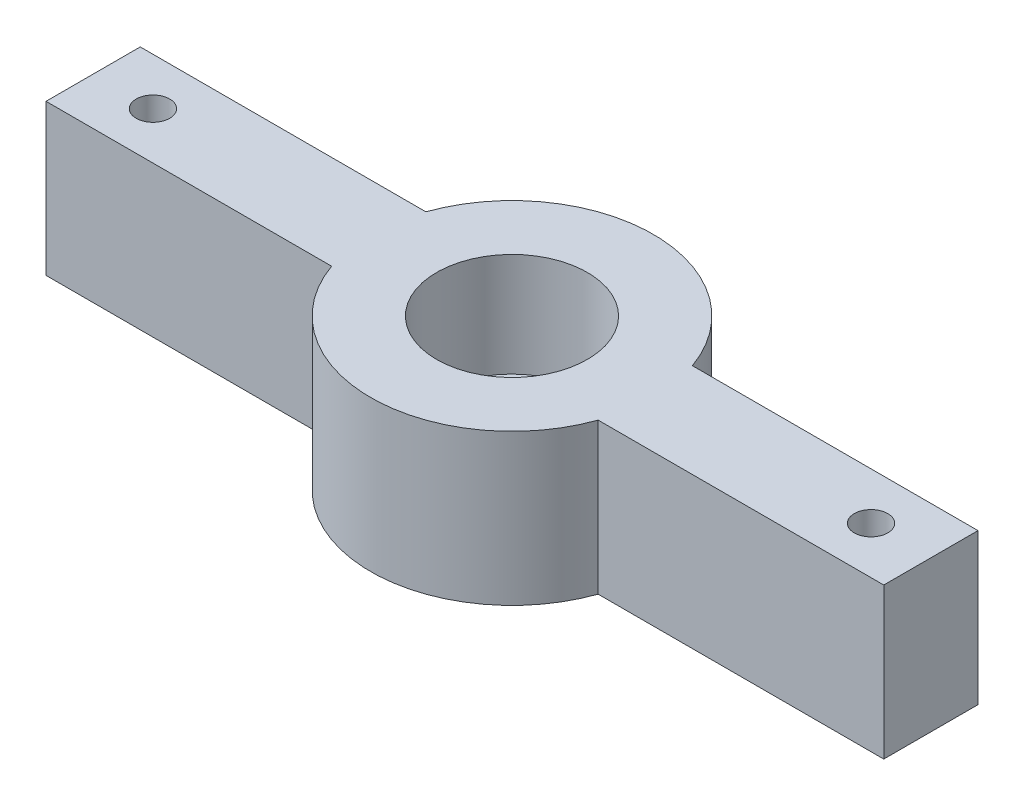
from build123d import *

# Parameters (mm, degrees)
SKETCH1_R           = 0.889
SKETCH1_R_2         = 1.875
BOSS_EXTRUDE1_DEPTH = 8
SKETCH2_R           = 4
CUT_EXTRUDE1_DEPTH  = 5.5


with BuildPart() as part:
    # Sketch1 → Boss-Extrude1 (new body)
    with BuildSketch(Plane(origin=(0, 0, 0), x_dir=(1, 0, 0), z_dir=(0, 1, 0))):
        with BuildLine():
            Line((-22.225, 2.5), (-22.225, -2.5))
            Line((-22.225, -2.5), (-7.071067812, -2.5))
            ThreePointArc((-7.071067812, -2.5), (0, -7.5), (7.071067812, -2.5))
            Line((7.071067812, -2.5), (22.225, -2.5))
            Line((22.225, -2.5), (22.225, 2.5))
            Line((22.225, 2.5), (7.071067812, 2.5))
            ThreePointArc((7.071067812, 2.5), (0, 7.5), (-7.071067812, 2.5))
            Line((-7.071067812, 2.5), (-22.225, 2.5))
        make_face()
        with Locations(Location((-19.05, 0, 0), (0, 0, 270))):
            Circle(SKETCH1_R, mode=Mode.SUBTRACT)
        with Locations(Location((0, 0, 0), (0, 0, 270))):
            Circle(SKETCH1_R_2, mode=Mode.SUBTRACT)
        with Locations(Location((19.05, 0, 0), (0, 0, 90))):
            Circle(SKETCH1_R, mode=Mode.SUBTRACT)
    extrude(amount=BOSS_EXTRUDE1_DEPTH)

    # Sketch2 → Cut-Extrude1 (cut)
    with BuildSketch(Plane(origin=(0, 8, 0), x_dir=(1, 0, 0), z_dir=(0, 1, 0))):
        with Locations(Location((0, 0, 0), (0, 0, 270))):
            Circle(SKETCH2_R)
    extrude(amount=-CUT_EXTRUDE1_DEPTH, mode=Mode.SUBTRACT)


solid = part.part
